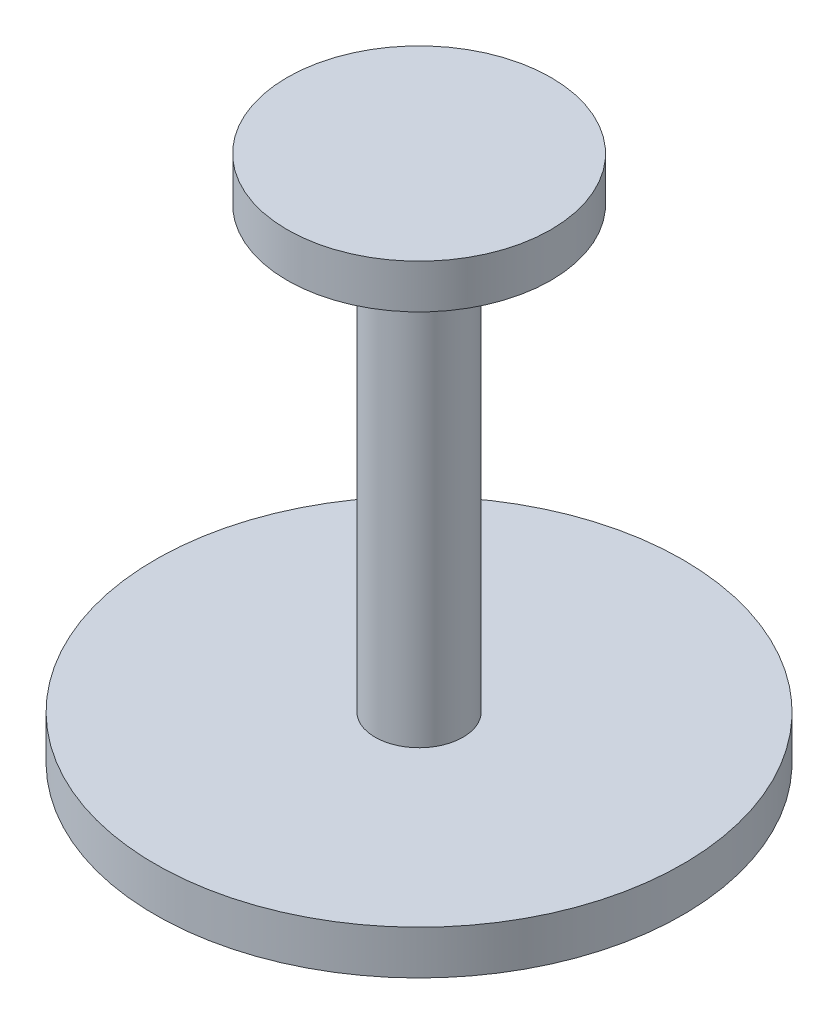
from build123d import *


with BuildPart() as part:
    # Sketch2 → Revolve1 (revolve)
    with BuildSketch(Plane.XY, mode=Mode.PRIVATE) as revolve1_sk:
        Polygon((0, 0), (0, 76.2), (19.05, 76.2), (19.05, 69.85), (6.35, 69.85), (6.35, 6.35), (38.1, 6.35), (38.1, 0), align=None)
    revolve(revolve1_sk.sketch.rotate(Axis((0, 0, 0), (0, 1, 0)), 90), axis=Axis((0, 0, 0), (0, 1, 0)))


solid = part.part
